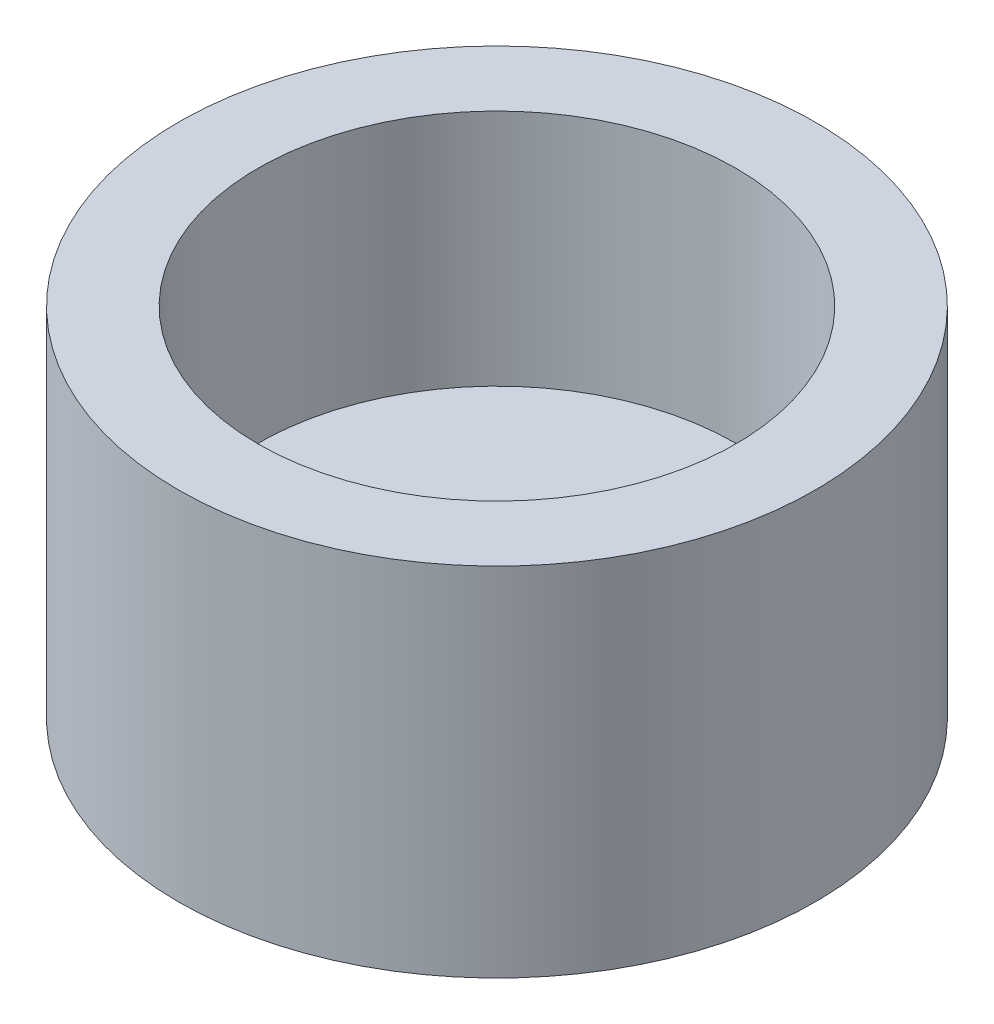
from build123d import *

# Parameters (mm, degrees)
ESQUISSE1_R             = 25.4
BOSS_EXTRU_1_DEPTH      = 28.45
ESQUISSE2_R             = 19.05
ENL_V_MAT_EXTRU_1_DEPTH = 19


with BuildPart() as part:
    # Esquisse1 → Boss.-Extru.1 (new body)
    with BuildSketch(Plane(origin=(0, 0, 0), x_dir=(1, 0, 0), z_dir=(0, 1, 0))):
        with Locations(Location((0, 0, 0), (0, 0, 270))):
            Circle(ESQUISSE1_R)
    extrude(amount=BOSS_EXTRU_1_DEPTH)

    # Esquisse2 → Enlèv. mat.-Extru.1 (cut)
    with BuildSketch(Plane(origin=(0, 28.45, 0), x_dir=(1, 0, 0), z_dir=(0, 1, 0))):
        with Locations(Location((0, 0, 0), (0, 0, 270))):
            Circle(ESQUISSE2_R)
    extrude(amount=-ENL_V_MAT_EXTRU_1_DEPTH, mode=Mode.SUBTRACT)


solid = part.part
